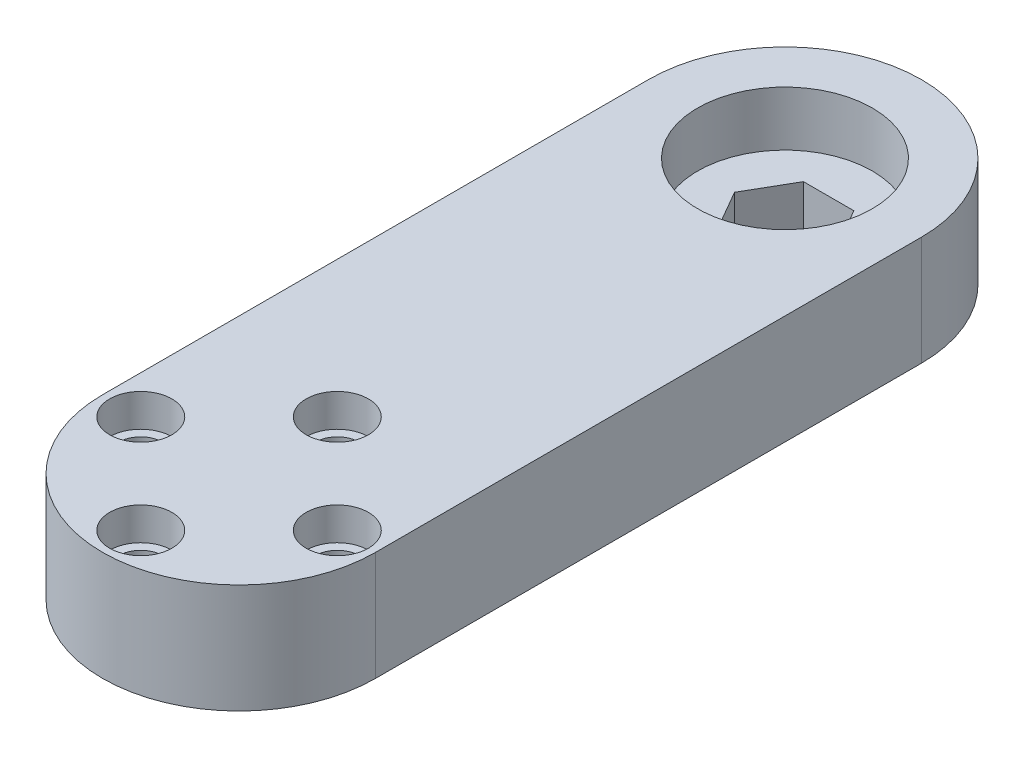
from build123d import *

# Parameters (mm, degrees)
BOSS_EXTRUDE1_DEPTH = 10
SKETCH2_R           = 2.85
CUT_EXTRUDE1_DEPTH  = 3
SKETCH3_R           = 2
CUT_EXTRUDE2_DEPTH  = 65.517439503
SKETCH4_R           = 8
CUT_EXTRUDE5_DEPTH  = 5
SKETCH6_R           = 3.5
CUT_EXTRUDE6_DEPTH  = 65.517439503
CUT_EXTRUDE7_DEPTH  = 65.517439503


with BuildPart() as part:
    # Sketch1 → Boss-Extrude1 (new body)
    with BuildSketch(Plane(origin=(0, 0, 0), x_dir=(1, 0, 0), z_dir=(0, 1, 0))):
        with BuildLine():
            Line((-12.5, 0), (-12.5, 50))
            ThreePointArc((-12.5, 50), (0, 62.5), (12.5, 50))
            Line((12.5, 50), (12.5, 0))
            ThreePointArc((12.5, 0), (0, -12.5), (-12.5, 0))
        make_face()
    extrude(amount=BOSS_EXTRUDE1_DEPTH)

    # Sketch2 → Cut-Extrude1 (cut)
    with BuildSketch(Plane(origin=(0, 10, 0), x_dir=(1, 0, 0), z_dir=(0, 1, 0))):
        with Locations(Location((0, 9, 0), (0, 0, 270))):
            Circle(SKETCH2_R)
        with Locations(Location((9, 0, 0), (0, 0, 270))):
            Circle(SKETCH2_R)
        with Locations(Location((0, -9, 0), (0, 0, 270))):
            Circle(SKETCH2_R)
        with Locations(Location((-9, 0, 0), (0, 0, 270))):
            Circle(SKETCH2_R)
    extrude(amount=-CUT_EXTRUDE1_DEPTH, mode=Mode.SUBTRACT)

    # Sketch3 → Cut-Extrude2 (cut, through all)
    with BuildSketch(Plane(origin=(0, 10, 0), x_dir=(1, 0, 0), z_dir=(0, 1, 0))):
        with Locations(Location((0, 9, 0), (0, 0, 270))):
            Circle(SKETCH3_R)
        with Locations(Location((9, 0, 0), (0, 0, 270))):
            Circle(SKETCH3_R)
        with Locations(Location((0, -9, 0), (0, 0, 270))):
            Circle(SKETCH3_R)
        with Locations(Location((-9, 0, 0), (0, 0, 270))):
            Circle(SKETCH3_R)
    extrude(amount=-CUT_EXTRUDE2_DEPTH, mode=Mode.SUBTRACT)

    # Sketch4 → Cut-Extrude5 (cut)
    with BuildSketch(Plane.XZ.offset(-10)):
        with Locations(Location((0, -50, 0), (0, 0, 270))):
            Circle(SKETCH4_R)
    extrude(amount=CUT_EXTRUDE5_DEPTH, mode=Mode.SUBTRACT)

    # Sketch6 → Cut-Extrude6 (cut, through all)
    with BuildSketch(Plane(origin=(0, 10, 0), x_dir=(1, 0, 0), z_dir=(0, 1, 0))):
        with Locations(Location((0, 50, 0), (0, 0, 270))):
            Circle(SKETCH6_R)
    extrude(amount=-CUT_EXTRUDE6_DEPTH, mode=Mode.SUBTRACT)

    # Sketch7 → Cut-Extrude7 (cut, through all)
    with BuildSketch(Plane.XZ):
        Polygon((4.618802154, -50), (2.309401077, -46), (-2.309401077, -46), (-4.618802154, -50), (-2.309401077, -54), (2.309401077, -54), align=None)
    extrude(amount=-CUT_EXTRUDE7_DEPTH, mode=Mode.SUBTRACT)


solid = part.part
